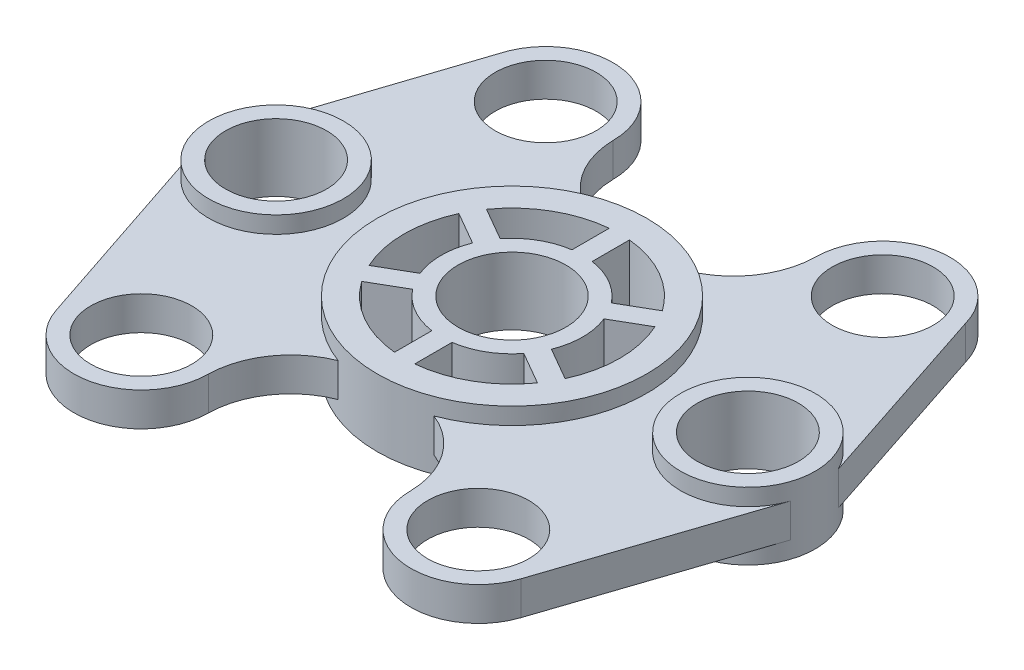
from build123d import *

# Parameters (mm, degrees)
SKETCH1_R             = 20
SKETCH1_R_2           = 15
BOSS_EXTRUDE4_DEPTH   = 10
SKETCH1_R_3           = 40
SKETCH1_R_4           = 16
BOSS_EXTRUDE4_2_DEPTH = 10
BOSS_EXTRUDE4_3_DEPTH = 10
SKETCH1_7_R           = 15
BOSS_EXTRUDE5_DEPTH   = 5


with BuildPart() as part:
    # Sketch1 → Boss-Extrude4 (new, symmetric)
    with BuildSketch(Plane(origin=(0, 0, 0), x_dir=(1, 0, 0), z_dir=(0, 1, 0))):
        with Locations((70, 0)):
            Circle(SKETCH1_R)
        with Locations((70, 0)):
            Circle(SKETCH1_R_2, mode=Mode.SUBTRACT)
    extrude(amount=BOSS_EXTRUDE4_DEPTH, both=True)



with BuildPart() as body_2:
    # Sketch1 → Boss-Extrude4 2 (new, symmetric)
    with BuildSketch(Plane(origin=(0, 0, 0), x_dir=(1, 0, 0), z_dir=(0, 1, 0))):
        Circle(SKETCH1_R_3)
        with BuildLine():
            ThreePointArc((-16.5, -12.990381057), (-10.5, -18.186533479), (-3, -20.784609691))
            Line((-3, -20.784609691), (-3, -31.859064644))
            ThreePointArc((-3, -31.859064644), (-16, -27.712812921), (-26.090759323, -18.527608533))
            Line((-26.090759323, -18.527608533), (-16.5, -12.990381057))
        make_face(mode=Mode.SUBTRACT)
        with BuildLine():
            Line((3, -31.859064644), (3, -20.784609691))
            ThreePointArc((3, -20.784609691), (10.5, -18.186533479), (16.5, -12.990381057))
            Line((16.5, -12.990381057), (26.090759323, -18.527608533))
            ThreePointArc((26.090759323, -18.527608533), (16, -27.712812921), (3, -31.859064644))
        make_face(mode=Mode.SUBTRACT)
        with BuildLine():
            ThreePointArc((19.5, -7.794228634), (21, 0), (19.5, 7.794228634))
            Line((19.5, 7.794228634), (29.090759323, 13.331456111))
            ThreePointArc((29.090759323, 13.331456111), (32, 0), (29.090759323, -13.331456111))
            Line((29.090759323, -13.331456111), (19.5, -7.794228634))
        make_face(mode=Mode.SUBTRACT)
        with BuildLine():
            ThreePointArc((-19.5, 7.794228634), (-21, 0), (-19.5, -7.794228634))
            Line((-19.5, -7.794228634), (-29.090759323, -13.331456111))
            ThreePointArc((-29.090759323, -13.331456111), (-32, 0), (-29.090759323, 13.331456111))
            Line((-29.090759323, 13.331456111), (-19.5, 7.794228634))
        make_face(mode=Mode.SUBTRACT)
        with BuildLine():
            ThreePointArc((-3, 20.784609691), (-10.5, 18.186533479), (-16.5, 12.990381057))
            Line((-16.5, 12.990381057), (-26.090759323, 18.527608533))
            ThreePointArc((-26.090759323, 18.527608533), (-16, 27.712812921), (-3, 31.859064644))
            Line((-3, 31.859064644), (-3, 20.784609691))
        make_face(mode=Mode.SUBTRACT)
        Circle(SKETCH1_R_4, mode=Mode.SUBTRACT)
        with BuildLine():
            ThreePointArc((16.5, 12.990381057), (10.5, 18.186533479), (3, 20.784609691))
            Line((3, 20.784609691), (3, 31.859064644))
            ThreePointArc((3, 31.859064644), (16, 27.712812921), (26.090759323, 18.527608533))
            Line((26.090759323, 18.527608533), (16.5, 12.990381057))
        make_face(mode=Mode.SUBTRACT)
    extrude(amount=BOSS_EXTRUDE4_2_DEPTH, both=True)


with BuildPart() as body_3:
    # Sketch1 → Boss-Extrude4 3 (new, symmetric)
    with BuildSketch(Plane(origin=(0, 0, 0), x_dir=(1, 0, 0), z_dir=(0, 1, 0))):
        with Locations((-70, 0)):
            Circle(SKETCH1_R)
        with Locations((-70, 0)):
            Circle(SKETCH1_R_2, mode=Mode.SUBTRACT)
    extrude(amount=BOSS_EXTRUDE4_3_DEPTH, both=True)


with BuildPart() as part_1:
    add(part.part)

    add(body_2.part)  # Boss-Extrude5 merges body 2

    add(body_3.part)  # Boss-Extrude5 merges body 3
    # Sketch1<7> → Boss-Extrude5 (add, symmetric)
    # profile 1 of 2: a face of its own
    with BuildSketch(Plane(origin=(0, 0, 0), x_dir=(1, 0, 0), z_dir=(0, 1, 0))):
        with BuildLine():
            Line((87.870632354, 8.980005528), (69.28006665, 65.317803116))
            ThreePointArc((69.28006665, 65.317803116), (47.316842625, 79.819199441), (30, 60))
            ThreePointArc((30, 60), (25.532838196, 46.305506483), (14.221544564, 37.38646373))
            ThreePointArc((14.221544564, 37.38646373), (40, 0), (14.221544564, -37.38646373))
            ThreePointArc((14.221544564, -37.38646373), (25.532838196, -46.305506483), (30, -60))
            ThreePointArc((30, -60), (46.79635514, -79.741749153), (68.973665961, -66.32455532))
            Line((68.973665961, -66.32455532), (88.973665961, -6.32455532))
            ThreePointArc((88.973665961, -6.32455532), (50.051742551, -1.437715109), (87.870632354, 8.980005528))
        make_face()
        with Locations((50, -60)):
            Circle(SKETCH1_7_R, mode=Mode.SUBTRACT)
        with Locations((50, 60)):
            Circle(SKETCH1_7_R, mode=Mode.SUBTRACT)
    # profile 2 of 2: a face of its own
    with BuildSketch(Plane(origin=(0, 0, 0), x_dir=(1, 0, 0), z_dir=(0, 1, 0))):
        with BuildLine():
            ThreePointArc((-14.221544564, -37.38646373), (-40, 0), (-14.221544564, 37.38646373))
            ThreePointArc((-14.221544564, 37.38646373), (-25.532838196, 46.305506483), (-30, 60))
            ThreePointArc((-30, 60), (-47.316842625, 79.819199441), (-69.28006665, 65.317803116))
            Line((-69.28006665, 65.317803116), (-87.870632354, 8.980005528))
            ThreePointArc((-87.870632354, 8.980005528), (-50.051742551, -1.437715109), (-88.973665961, -6.32455532))
            Line((-88.973665961, -6.32455532), (-68.973665961, -66.32455532))
            ThreePointArc((-68.973665961, -66.32455532), (-46.79635514, -79.741749153), (-30, -60))
            ThreePointArc((-30, -60), (-25.532838196, -46.305506483), (-14.221544564, -37.38646373))
        make_face()
        with Locations((-50, -60)):
            Circle(SKETCH1_7_R, mode=Mode.SUBTRACT)
        with Locations((-50, 60)):
            Circle(SKETCH1_7_R, mode=Mode.SUBTRACT)
    extrude(amount=BOSS_EXTRUDE5_DEPTH, both=True)


solid = part_1.part
